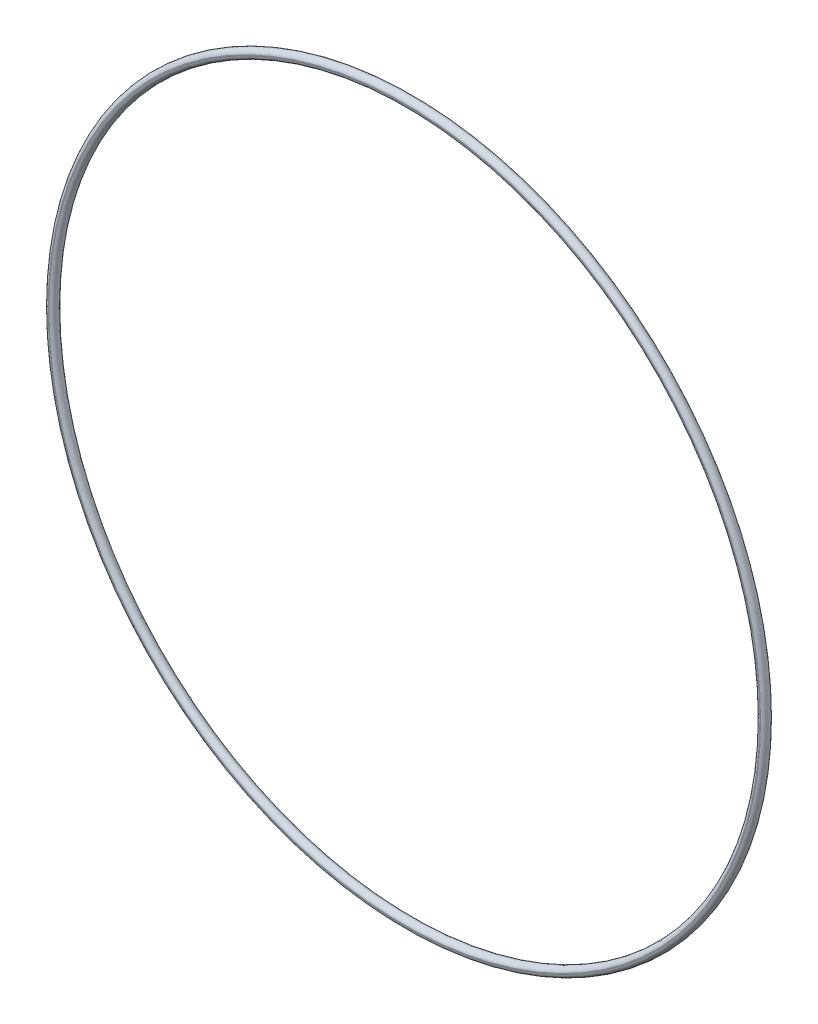
from build123d import *

# Parameters (mm, degrees)
SKETCH1_W = 0.214483614
SKETCH1_H = 2.607393184


with BuildPart() as part:
    # Sketch1 → Revolve1 (revolve)
    with BuildSketch(Plane(origin=(0, 0, 0), x_dir=(0, -1, 0), z_dir=(1, 0, 0)), mode=Mode.PRIVATE) as revolve1_sk:
        with BuildLine():
            ThreePointArc((99.460758193, 1.303696592), (98.2599, 0), (99.460758193, -1.303696592))
            Line((99.460758193, -1.303696592), (99.460758193, 1.303696592))
        make_face()
        with BuildLine():
            Line((99.675241807, 1.303696592), (99.675241807, -1.303696592))
            ThreePointArc((99.675241807, -1.303696592), (100.530135286, -0.886239979), (100.8761, 0))
            ThreePointArc((100.8761, 0), (100.530135286, 0.886239979), (99.675241807, 1.303696592))
        make_face()
        with Locations((99.568, 0)):
            Rectangle(SKETCH1_W, SKETCH1_H)
    revolve(revolve1_sk.sketch.rotate(Axis((0, 0, 1.3081), (0, 0, -1)), 270), axis=Axis((0, 0, 1.3081), (0, 0, -1)))


solid = part.part
